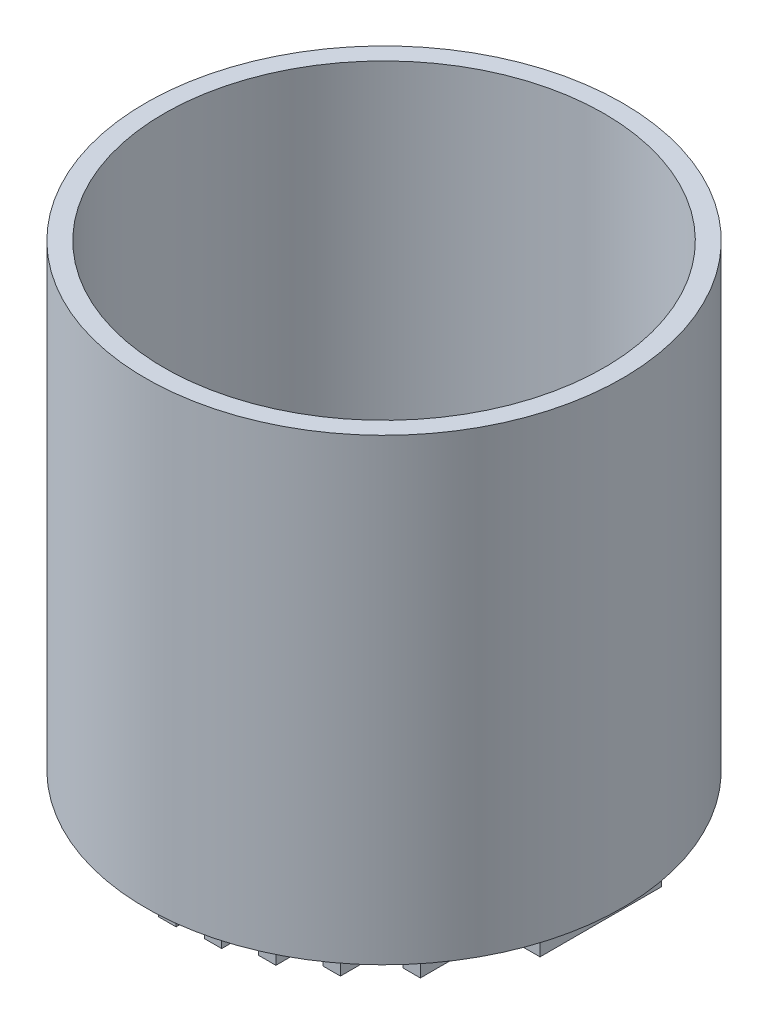
from build123d import *

# Parameters (mm, degrees)
SKETCH1_R           = 38.1
BOSS_EXTRUDE1_DEPTH = 76.2
SHELL2_T            = 3.175
SKETCH2_W           = 3
SKETCH2_H           = 75
SKETCH2_H_2         = 48.033738144
SKETCH2_H_3         = 61.308726948
SKETCH2_H_4         = 69.24998195
SKETCH2_H_5         = 73.60461942
BOSS_EXTRUDE2_DEPTH = 4


with BuildPart() as part:
    # Sketch1 → Boss-Extrude1 (new body)
    with BuildSketch(Plane(origin=(0, 0, 0), x_dir=(1, 0, 0), z_dir=(0, 1, 0))):
        with Locations(Location((0, 0, 0), (0, 0, 90))):
            Circle(SKETCH1_R)
    extrude(amount=BOSS_EXTRUDE1_DEPTH)

    # Shell2
    shell2_openings = [part.faces().sort_by_distance(p)[0] for p in [
        (0, 76.2, 0),
    ]]
    offset(amount=SHELL2_T, openings=shell2_openings, kind=Kind.INTERSECTION)

    # Sketch2 → Boss-Extrude2 (add)
    with BuildSketch(Plane.XZ.offset(3.175)):
        Rectangle(SKETCH2_W, SKETCH2_H)
        Polygon((-34.5, -10.5), (-34.5, 0), (-34.5, 10.5), (-37.5, 10.5), (-37.5, -10.5), align=None)
        with Locations((-28.8, 0)):
            Rectangle(SKETCH2_W, SKETCH2_H_2)
        with Locations((-21.6, 0)):
            Rectangle(SKETCH2_W, SKETCH2_H_3)
        with Locations((-14.4, 0)):
            Rectangle(SKETCH2_W, SKETCH2_H_4)
        with Locations((-7.2, 0)):
            Rectangle(SKETCH2_W, SKETCH2_H_5)
        Polygon((8.7, -36.80230971), (8.7, 0), (8.7, 36.80230971), (5.7, 36.80230971), (5.7, -36.80230971), align=None)
        with Locations((14.4, 0)):
            Rectangle(SKETCH2_W, SKETCH2_H_4)
        with Locations((21.6, 0)):
            Rectangle(SKETCH2_W, SKETCH2_H_3)
        with Locations((28.8, 0)):
            Rectangle(SKETCH2_W, SKETCH2_H_2)
        Polygon((37.5, -10.5), (37.5, 10.5), (34.5, 10.5), (34.5, 0), (34.5, -10.5), align=None)
    extrude(amount=BOSS_EXTRUDE2_DEPTH)


solid = part.part
